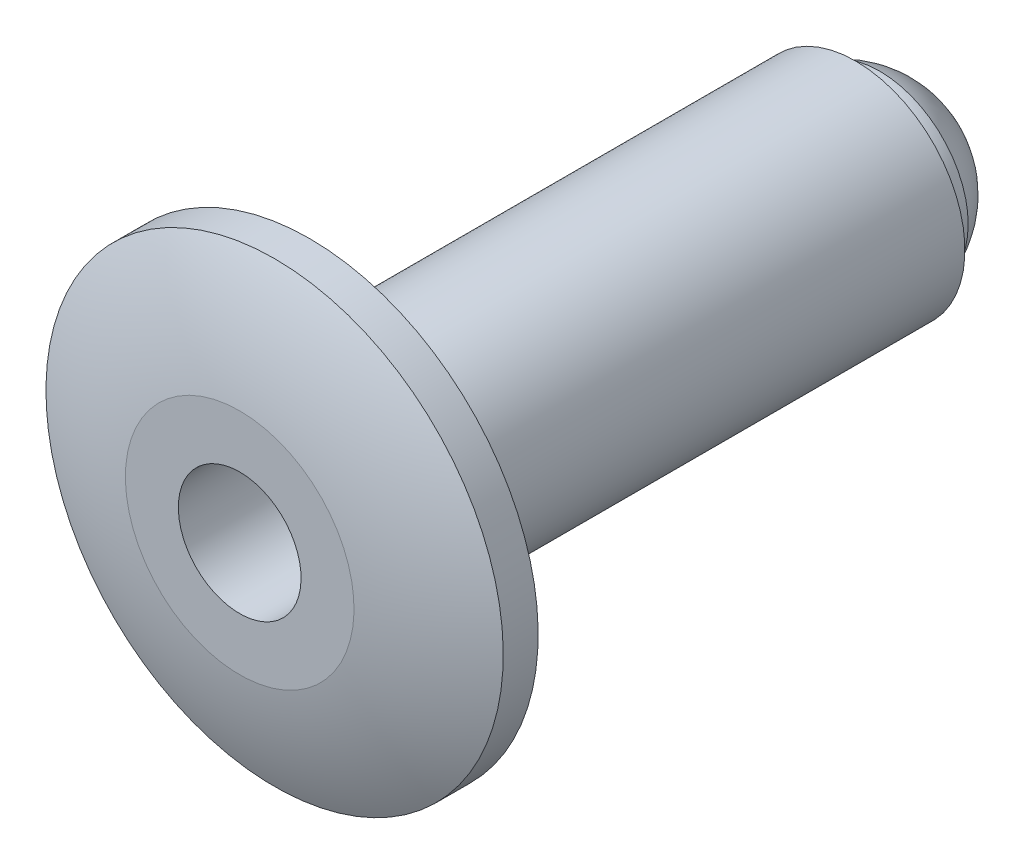
from build123d import *

# Parameters (mm, degrees)
CUT_EXTRUDE1_DEPTH      = 14.770273365
CIRPATTERN1_COUNT       = 2
CIRPATTERN1_ANGLE       = 90
SKETCH9_W               = 0.0984853
SKETCH9_H               = 0.0254
SKETCH9_W_2             = 0.098485299
CUT_EXTRUDE2_DEPTH      = 13.82013896
CUT_EXTRUDE2_DEPTH_BACK = 1.81102
SKETCH10_R              = 0.79375


with BuildPart() as part:
    # Sketch2 → Revolve1 (revolve)
    with BuildSketch(Plane(origin=(0, 0, 0), x_dir=(0, 0, -1), z_dir=(1, 0, 0))):
        with BuildLine():
            Line((7.9502, 1.5875), (0, 1.5875))
            Line((0, 1.5875), (0, 3.3274))
            Line((0, 3.3274), (-0.508, 3.3274))
            ThreePointArc((-0.508, 3.3274), (-0.823736431, 2.514400819), (-1.016, 1.6637))
            Line((-1.016, 1.6637), (-1.016, 0.89296875))
            Line((-1.016, 0.89296875), (0, 0.89296875))
            Line((0, 0.89296875), (0.79502, 0.89296875))
            Line((0.79502, 0.89296875), (0.79502, 0))
            Line((0.79502, 0), (7.9502, 0))
            Line((7.9502, 0), (7.9502, 1.5875))
        make_face()
    revolve(axis=Axis((0, 0, -7.9502), (0, 0, 1)))

    # Sketch9 → Revolve4 (revolve)
    with BuildSketch(Plane(origin=(0, 0, 0), x_dir=(1, 0, 0), z_dir=(0, 1, 0))):
        with Locations((2.084848675, 0.0127)):
            Rectangle(SKETCH9_W, SKETCH9_H)
        with Locations((2.357323627, 0.0127)):
            Rectangle(SKETCH9_W, SKETCH9_H)
        with Locations((2.600252293, 0.0127)):
            Rectangle(SKETCH9_W_2, SKETCH9_H)
        with Locations((2.951516006, 0.0127)):
            Rectangle(SKETCH9_W, SKETCH9_H)
        with Locations((1.858332834, 0.0127)):
            Rectangle(SKETCH9_W, SKETCH9_H)
    revolve(axis=Axis((0, 0, 12.9413), (0, 0, -1)))


with BuildPart() as body_2:
    # Sketch7 → Revolve2 (revolve)
    with BuildSketch(Plane(origin=(0, 0, 0), x_dir=(0, 0, -1), z_dir=(1, 0, 0))):
        with BuildLine():
            Line((-12.188329368, 0.79375), (0.79502, 0.79375))
            Line((0.79502, 0.79375), (0.79502, 0))
            Line((0.79502, 0), (-12.9413, 0))
            ThreePointArc((-12.9413, 0), (-12.908763915, 0.146760795), (-12.817252416, 0.266020902))
            Line((-12.817252416, 0.266020902), (-12.188329368, 0.79375))
        make_face()
    revolve(axis=Axis((0, 0, 12.9413), (0, 0, -1)))

    # Sketch3 → Cut-Extrude1 (cut, symmetric)
    with BuildSketch(Plane(origin=(0, 0, 0), x_dir=(1, 0, 0), z_dir=(0, 1, 0))):
        Polygon((-0.99695, -10.809041225), (-0.220871274, -12.9413), (0.220871274, -12.9413), (0.99695, -10.809041225), (0.99695, -13.4493), (-0.99695, -13.4493), align=None)
    cut_extrude1 = extrude(amount=CUT_EXTRUDE1_DEPTH, both=True, mode=Mode.SUBTRACT)

    # CirPattern1: Cut-Extrude1 ×2 about axis
    cirpattern1_axis = Axis((0, 0, 12.9413), (0, 0, -1))
    for i in range(1, CIRPATTERN1_COUNT):
        add(cut_extrude1.rotate(cirpattern1_axis, i * CIRPATTERN1_ANGLE / (CIRPATTERN1_COUNT - 1)), mode=Mode.SUBTRACT)

    # Sketch10 → Cut-Extrude2 (cut, two sides: drawn at the far end of the back side and taken through both)
    with BuildSketch(Plane.XY.offset(1.016).offset(-CUT_EXTRUDE2_DEPTH_BACK)):
        Circle(SKETCH10_R)
    extrude(amount=CUT_EXTRUDE2_DEPTH + CUT_EXTRUDE2_DEPTH_BACK, mode=Mode.SUBTRACT)


with BuildPart() as body_3:
    # Sketch8 → Revolve3 (revolve)
    with BuildSketch(Plane(origin=(0, 0, 0), x_dir=(0, 0, -1), z_dir=(1, 0, 0)), mode=Mode.PRIVATE) as revolve3_sk:
        with BuildLine():
            Line((7.9502, 1.27), (7.9502, 0))
            Line((7.9502, 0), (9.151408333, 0))
            ThreePointArc((9.151408333, 0), (8.919094503, 0.77126382), (8.29945, 1.285907664))
            ThreePointArc((8.29945, 1.285907664), (8.124284091, 1.289829403), (7.9502, 1.27))
        make_face()
    revolve(revolve3_sk.sketch.rotate(Axis((0, 0, -7.9502), (0, 0, -1)), 90), axis=Axis((0, 0, -7.9502), (0, 0, -1)))


solid = Compound([part.part, body_3.part])
